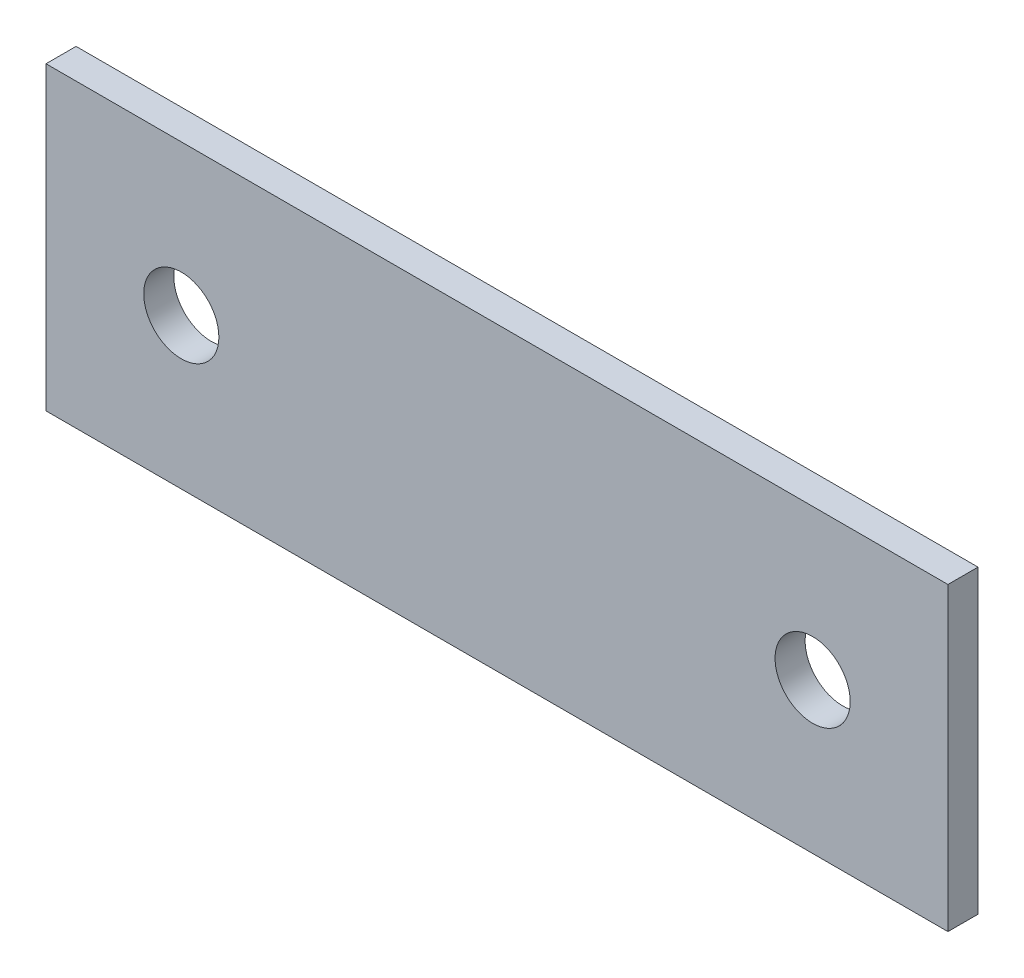
from build123d import *

# Parameters (mm, degrees)
SKETCH_1_W      = 60
SKETCH_1_H      = 20
SKETCH_1_R      = 2.5
EXTRUDE_1_DEPTH = 2


with BuildPart() as part:
    # 草图1 → 凸台-拉伸1 (new body)
    with BuildSketch(Plane.XY):
        Rectangle(SKETCH_1_W, SKETCH_1_H)
        with Locations((-21, 0)):
            Circle(SKETCH_1_R, mode=Mode.SUBTRACT)
        with Locations((21, 0)):
            Circle(SKETCH_1_R, mode=Mode.SUBTRACT)
    extrude(amount=EXTRUDE_1_DEPTH)


solid = part.part
